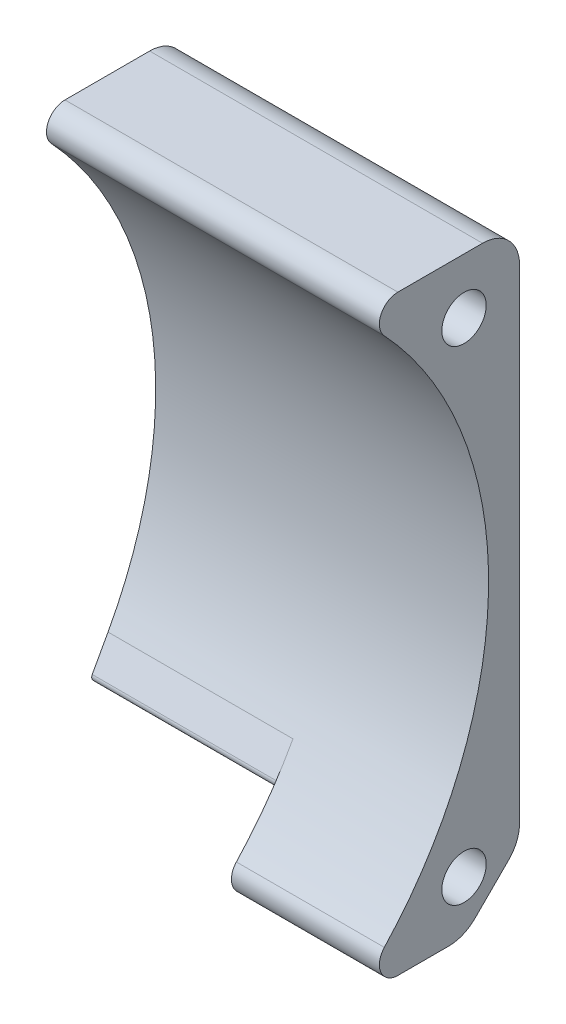
from build123d import *

# Parameters (mm, degrees)
BOSS_EXTRUDE1_DEPTH = 28.575
CHAMFER1_SIZE       = 4.7625
FILLET3_R           = 3.175
CUT_EXTRUDE1_START  = -12.7
CUT_EXTRUDE1_DEPTH  = 48.337684469
FILLET4_R           = 0.396875
FILLET5_R           = 3.175
FILLET6_R           = 1.5875
SKETCH3_R           = 1.905
CUT_EXTRUDE2_DEPTH  = 60.514034165


with BuildPart() as part:
    # Sketch1 → Boss-Extrude1 (new body)
    with BuildSketch(Plane(origin=(0, 0, 0), x_dir=(0, 0, -1), z_dir=(1, 0, 0))):
        with BuildLine():
            Line((0, 0), (-14.399754562, 0))
            ThreePointArc((-14.399754562, 0), (-2.654588994, -25.4), (-14.399754562, -50.8))
            Line((-14.399754562, -50.8), (0, -50.8))
            Line((0, -50.8), (0, 0))
        make_face()
    extrude(amount=BOSS_EXTRUDE1_DEPTH)

    # Chamfer1
    chamfer1_edges = [part.edges().sort_by_distance(p)[0] for p in [
        (14.2875, -50.8, 0),
    ]]
    chamfer(chamfer1_edges, length=CHAMFER1_SIZE)

    # Fillet3
    fillet3_edges = [part.edges().sort_by_distance(p)[0] for p in [
        (14.2875, -46.0375, 0),
        (14.2875, -50.8, 4.7625),
    ]]
    fillet(fillet3_edges, radius=FILLET3_R)

    # Sketch2 → Cut-Extrude1 (cut, through all)
    with BuildSketch(Plane(origin=(28.575, 0, 0), x_dir=(0, 0, -1), z_dir=(1, 0, 0)).offset(CUT_EXTRUDE1_START)):
        with BuildLine():
            Line((-9.432233183, -46.30987194), (-6.747973263, -41.405330404))
            ThreePointArc((-6.747973263, -41.405330404), (-10.143469679, -46.453213193), (-14.399754562, -50.8))
            Line((-14.399754562, -50.8), (-6.077628061, -50.8))
            ThreePointArc((-6.077628061, -50.8), (-4.862608163, -50.558317516), (-3.83256403, -49.87006403))
            Line((-3.83256403, -49.87006403), (-0.92993597, -46.96743597))
            ThreePointArc((-0.92993597, -46.96743597), (-0.583051244, -46.556064021), (-0.31061766, -46.092021096))
            Line((-0.31061766, -46.092021096), (-4.7625, -41.640138757))
            Line((-4.7625, -41.640138757), (-9.432233183, -46.30987194))
        make_face()
    extrude(amount=-CUT_EXTRUDE1_DEPTH, mode=Mode.SUBTRACT)

    # Fillet4
    fillet4_edges = [part.edges().sort_by_distance(p)[0] for p in [
        (7.9375, -46.30987194, 9.432233183),
    ]]
    fillet(fillet4_edges, radius=FILLET4_R)

    # Fillet5
    fillet5_edges = [part.edges().sort_by_distance(p)[0] for p in [
        (14.2875, 0, 0),
    ]]
    fillet(fillet5_edges, radius=FILLET5_R)

    # Fillet6
    fillet6_edges = [part.edges().sort_by_distance(p)[0] for p in [
        (22.225, -50.8, 14.399754562),
        (14.2875, 0, 14.399754562),
    ]]
    fillet(fillet6_edges, radius=FILLET6_R)

    # Sketch3 → Cut-Extrude2 (cut, through all)
    with BuildSketch(Plane(origin=(28.575, 0, 0), x_dir=(0, 0, -1), z_dir=(1, 0, 0))):
        with Locations((-4.7625, -4.7625)):
            Circle(SKETCH3_R)
        with Locations((-4.7625, -46.309871939)):
            Circle(SKETCH3_R)
    extrude(amount=-CUT_EXTRUDE2_DEPTH, mode=Mode.SUBTRACT)


solid = part.part
